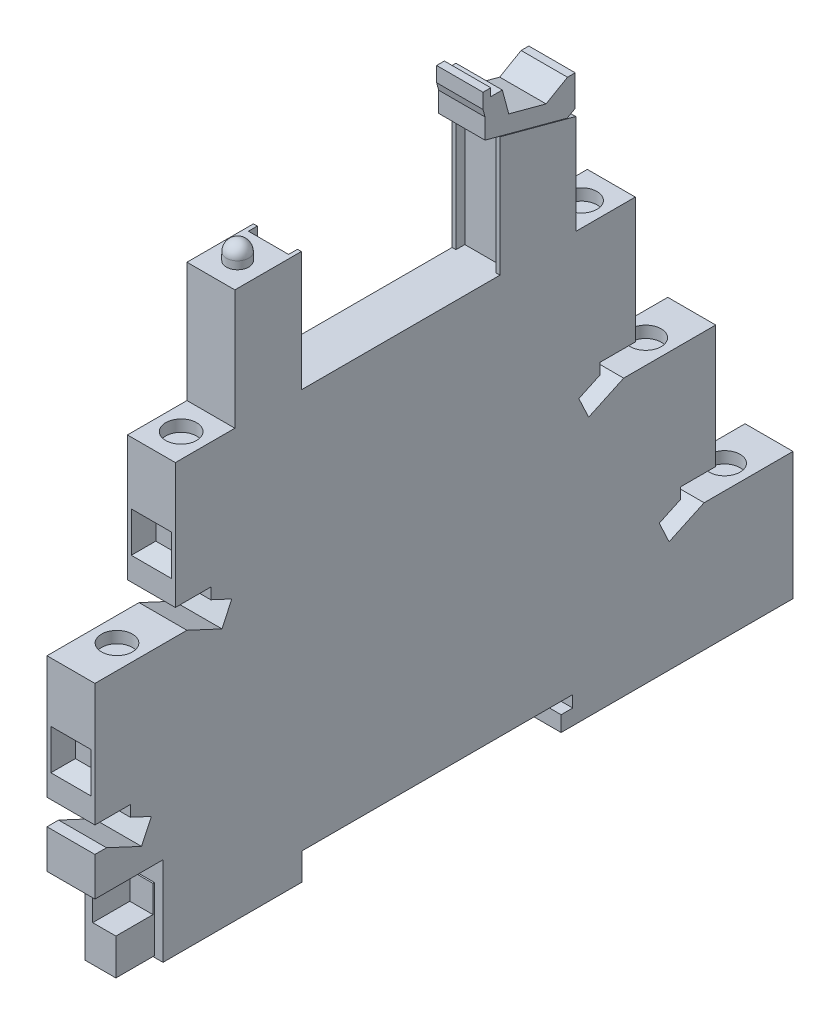
from build123d import *

# Parameters (mm, degrees)
BOSS_EXTRUDE1_DEPTH      = 6.2
SKETCH2_W                = 5.2
SKETCH2_H                = 28
CUT_EXTRUDE1_DEPTH       = 15.5
SKETCH3_R                = 1.45
BOSS_EXTRUDE2_DEPTH      = 1
DOME1_FACE_RADIUS        = 1.45
DOME1_HEIGHT             = 1.45
SKETCH4_W                = 4
SKETCH4_H                = 8.2
BOSS_EXTRUDE3_DEPTH      = 5
SKETCH5_W                = 3
SKETCH5_H                = 3.5
CUT_EXTRUDE2_DEPTH       = 4.8
SKETCH6_W                = 4
SKETCH6_H                = 2
BOSS_EXTRUDE4_DEPTH      = 1.5
BOSS_EXTRUDE4_TAPER      = 15
BOSS_EXTRUDE5_DEPTH      = 3
BOSS_EXTRUDE5_DEPTH_BACK = 3
SKETCH8_R                = 2
CUT_EXTRUDE3_DEPTH       = 1.5
SKETCH9_R                = 2
CUT_EXTRUDE4_DEPTH       = 1.5
SKETCH10_R               = 2
CUT_EXTRUDE5_DEPTH       = 1.5
SKETCH11_W               = 5.2
SKETCH11_H               = 5.2
CUT_EXTRUDE6_DEPTH       = 2.5
CUT_EXTRUDE6_DRAFT       = -15
SKETCH12_W               = 5.2
SKETCH12_H               = 5.2
CUT_EXTRUDE7_DEPTH       = 2.5
CUT_EXTRUDE7_DRAFT       = -15
SKETCH13_W               = 5.2
SKETCH13_H               = 5.2
CUT_EXTRUDE8_DEPTH       = 2.5
CUT_EXTRUDE8_DRAFT       = -15
SKETCH14_W               = 5.2
SKETCH14_H               = 5.2
CUT_EXTRUDE9_DEPTH       = 2.5
CUT_EXTRUDE9_DRAFT       = -15
SKETCH15_W               = 5.2
SKETCH15_H               = 5.2
CUT_EXTRUDE10_DEPTH      = 2.5
CUT_EXTRUDE10_DRAFT      = -15


with BuildPart() as part:
    # Sketch1 → Boss-Extrude1 (new body)
    with BuildSketch(Plane(origin=(0, 0, 0), x_dir=(0, 0, -1), z_dir=(1, 0, 0))):
        Polygon((0, 0), (0, 3.5), (35, 3.5), (35, 2), (33.5, 2), (33.5, 0), (63.5, 0), (63.5, 16.5), (52, 16.5), (47.468461065, 14.386908691), (46.20060628, 17.105832052), (48.919529641, 18.373686838), (48.919529641, 19.8), (53.5, 19.8), (53.5, 35.663086876), (41.594285018, 35.663086876), (37.062746083, 33.549995567), (35.794891298, 36.268918928), (38.513814659, 37.536773714), (38.513814659, 38.963086876), (43.094285018, 38.963086876), (43.094285018, 55.2), (35.394285018, 55.2), (35.394285018, 68.074097914), (25.594285018, 70.7), (25.594285018, 55.2), (-0.105714982, 55.2), (-0.105714982, 70.7), (-8.705714982, 70.7), (-8.705714982, 55.2), (-16.405714982, 55.2), (-16.405714982, 38.963086876), (-11.825244622, 38.963086876), (-11.825244622, 37.536773714), (-9.106321261, 36.268918928), (-10.374176047, 33.549995567), (-14.905714982, 35.663086876), (-26.811429963, 35.663086876), (-26.811429963, 19.8), (-22.230959604, 19.8), (-22.230959604, 18.373686838), (-19.512036243, 17.105832052), (-20.779891028, 14.386908691), (-25.311429963, 16.5), (-26.811429963, 16.5), (-26.811429963, 11.5), (-18, 11.5), (-18, 0), align=None)
    extrude(amount=BOSS_EXTRUDE1_DEPTH)

    # Sketch2 → Cut-Extrude1 (cut)
    with BuildSketch(Plane(origin=(0, 70.7, 0), x_dir=(1, 0, 0), z_dir=(0, 1, 0))):
        with Locations((3.1, 12.744285018)):
            Rectangle(SKETCH2_W, SKETCH2_H)
    extrude(amount=-CUT_EXTRUDE1_DEPTH, mode=Mode.SUBTRACT)

    # Sketch3 → Boss-Extrude2 (add)
    with BuildSketch(Plane(origin=(0, 70.7, 0), x_dir=(1, 0, 0), z_dir=(0, 1, 0))):
        with Locations(Location((3.1, -5.255714982, 0), (0, 0, 90))):
            Circle(SKETCH3_R)
    extrude(amount=BOSS_EXTRUDE2_DEPTH)

    # Dome1: a dome of height H over a round flat face of radius A is a cap of a sphere of radius (A * A + H * H) / (2 * H)
    dome1_r = (DOME1_FACE_RADIUS * DOME1_FACE_RADIUS + DOME1_HEIGHT * DOME1_HEIGHT) / (2 * DOME1_HEIGHT)
    dome1_base = Plane((3.1, 71.7, 5.255714982), z_dir=(0, 1, 0))
    with Locations(dome1_base.offset(DOME1_HEIGHT - dome1_r)):
        dome1_ball = Sphere(dome1_r, mode=Mode.PRIVATE)
    add(split(dome1_ball, bisect_by=dome1_base, keep=Keep.TOP, mode=Mode.PRIVATE))

    # Sketch4 → Boss-Extrude3 (add)
    with BuildSketch(Plane.XY.offset(18)):
        with Locations((3.1, 4.3)):
            Rectangle(SKETCH4_W, SKETCH4_H)
    extrude(amount=BOSS_EXTRUDE3_DEPTH)

    # Sketch5 → Cut-Extrude2 (cut)
    with BuildSketch(Plane.XY.offset(23)):
        with Locations((3.6, 6.65)):
            Rectangle(SKETCH5_W, SKETCH5_H)
    extrude(amount=-CUT_EXTRUDE2_DEPTH, mode=Mode.SUBTRACT)

    # Sketch6 → Boss-Extrude4 (add)
    with BuildSketch(Plane(origin=(0, 0, 0), x_dir=(-1, 0, 0), z_dir=(0, 0, -1))):
        with Locations((-3.1, 1)):
            Rectangle(SKETCH6_W, SKETCH6_H)
    extrude(amount=BOSS_EXTRUDE4_DEPTH, taper=BOSS_EXTRUDE4_TAPER)

    # Sketch7 → Boss-Extrude5 (add, two sides: drawn at the far end of the back side and taken through both)
    with BuildSketch(Plane(origin=(3.1, 0, 0), x_dir=(0, 0, -1), z_dir=(1, 0, 0)).offset(-BOSS_EXTRUDE5_DEPTH_BACK)):
        Polygon((34.380497445, 68.345741476), (23.755313356, 71.192750972), (23.755313356, 73.792750972), (23.496494311, 74.758676798), (23.496494311, 76.692750972), (24.496494311, 76.692750972), (24.496494311, 75.692750972), (25.996494311, 75.692750972), (26.824715255, 72.601788328), (31.654344387, 71.307693102), (34.425625679, 72.907693102), (35.425625679, 72.907693102), (35.425625679, 68.907693102), align=None)
    extrude(amount=BOSS_EXTRUDE5_DEPTH + BOSS_EXTRUDE5_DEPTH_BACK)

    # Sketch8 → Cut-Extrude3 (cut)
    with BuildSketch(Plane(origin=(0, 55.2, 0), x_dir=(1, 0, 0), z_dir=(0, 1, 0))):
        with Locations(Location((3.1, 39.244285018, 0), (0, 0, 270))):
            Circle(SKETCH8_R)
        with Locations(Location((3.1, -12.555714982, 0), (0, 0, 270))):
            Circle(SKETCH8_R)
    extrude(amount=-CUT_EXTRUDE3_DEPTH, mode=Mode.SUBTRACT)

    # Sketch9 → Cut-Extrude4 (cut)
    with BuildSketch(Plane(origin=(0, 35.663086876, 0), x_dir=(1, 0, 0), z_dir=(0, 1, 0))):
        with Locations(Location((3.1, 47.547142509, 0), (0, 0, 270))):
            Circle(SKETCH9_R)
        with Locations(Location((3.1, -20.858572473, 0), (0, 0, 270))):
            Circle(SKETCH9_R)
    extrude(amount=-CUT_EXTRUDE4_DEPTH, mode=Mode.SUBTRACT)

    # Sketch10 → Cut-Extrude5 (cut)
    with BuildSketch(Plane(origin=(0, 16.5, 0), x_dir=(1, 0, 0), z_dir=(0, 1, 0))):
        with Locations(Location((3.1, 57.75, 0), (0, 0, 270))):
            Circle(SKETCH10_R)
    extrude(amount=-CUT_EXTRUDE5_DEPTH, mode=Mode.SUBTRACT)


with BuildPart() as cut_extrude6_tool:
    # Sketch11 → Cut-Extrude6 (with draft: the straight prism first)
    with BuildSketch(Plane(origin=(0, 0, -63.5), x_dir=(-1, 0, 0), z_dir=(0, 0, -1))):
        with Locations((-3.1, 5.6)):
            Rectangle(SKETCH11_W, SKETCH11_H)
    extrude(amount=-CUT_EXTRUDE6_DEPTH)
    # Cut-Extrude6: the draft: its side faces are tilted about the plane it starts from
    cut_extrude6_sides = [cut_extrude6_tool.faces().sort_by_distance(p)[0] for p in [
        (3.1, 3, -62.25),
        (0.5, 5.6, -62.25),
        (3.1, 8.2, -62.25),
        (5.7, 5.6, -62.25),
    ]]
    draft(cut_extrude6_sides, Plane(origin=(0, 0, -63.5), x_dir=(-1, 0, 0), z_dir=(0, 0, -1)), CUT_EXTRUDE6_DRAFT)


with BuildPart() as part_1:
    add(part.part)

    # Cut-Extrude6: cut by cut_extrude6_tool
    add(cut_extrude6_tool.part, mode=Mode.SUBTRACT)


with BuildPart() as cut_extrude7_tool:
    # Sketch12 → Cut-Extrude7 (with draft: the straight prism first)
    with BuildSketch(Plane(origin=(0, 0, -53.5), x_dir=(-1, 0, 0), z_dir=(0, 0, -1))):
        with Locations((-3.1, 25.4)):
            Rectangle(SKETCH12_W, SKETCH12_H)
    extrude(amount=-CUT_EXTRUDE7_DEPTH)
    # Cut-Extrude7: the draft: its side faces are tilted about the plane it starts from
    cut_extrude7_sides = [cut_extrude7_tool.faces().sort_by_distance(p)[0] for p in [
        (3.1, 22.8, -52.25),
        (0.5, 25.4, -52.25),
        (3.1, 28, -52.25),
        (5.7, 25.4, -52.25),
    ]]
    draft(cut_extrude7_sides, Plane(origin=(0, 0, -53.5), x_dir=(-1, 0, 0), z_dir=(0, 0, -1)), CUT_EXTRUDE7_DRAFT)


with BuildPart() as part_2:
    add(part_1.part)

    # Cut-Extrude7: cut by cut_extrude7_tool
    add(cut_extrude7_tool.part, mode=Mode.SUBTRACT)


with BuildPart() as cut_extrude8_tool:
    # Sketch13 → Cut-Extrude8 (with draft: the straight prism first)
    with BuildSketch(Plane(origin=(0, 0, -43.094285018), x_dir=(-1, 0, 0), z_dir=(0, 0, -1))):
        with Locations((-3.1, 44.563086876)):
            Rectangle(SKETCH13_W, SKETCH13_H)
    extrude(amount=-CUT_EXTRUDE8_DEPTH)
    # Cut-Extrude8: the draft: its side faces are tilted about the plane it starts from
    cut_extrude8_sides = [cut_extrude8_tool.faces().sort_by_distance(p)[0] for p in [
        (3.1, 41.963086876, -41.844285018),
        (0.5, 44.563086876, -41.844285018),
        (3.1, 47.163086876, -41.844285018),
        (5.7, 44.563086876, -41.844285018),
    ]]
    draft(cut_extrude8_sides, Plane(origin=(0, 0, -43.094285018), x_dir=(-1, 0, 0), z_dir=(0, 0, -1)), CUT_EXTRUDE8_DRAFT)


with BuildPart() as part_3:
    add(part_2.part)

    # Cut-Extrude8: cut by cut_extrude8_tool
    add(cut_extrude8_tool.part, mode=Mode.SUBTRACT)


with BuildPart() as cut_extrude9_tool:
    # Sketch14 → Cut-Extrude9 (with draft: the straight prism first)
    with BuildSketch(Plane.XY.offset(26.811429963)):
        with Locations((3.1, 25.4)):
            Rectangle(SKETCH14_W, SKETCH14_H)
    extrude(amount=-CUT_EXTRUDE9_DEPTH)
    # Cut-Extrude9: the draft: its side faces are tilted about the plane it starts from
    cut_extrude9_sides = [cut_extrude9_tool.faces().sort_by_distance(p)[0] for p in [
        (3.1, 22.8, 25.561429963),
        (5.7, 25.4, 25.561429963),
        (3.1, 28, 25.561429963),
        (0.5, 25.4, 25.561429963),
    ]]
    draft(cut_extrude9_sides, Plane.XY.offset(26.811429963), CUT_EXTRUDE9_DRAFT)


with BuildPart() as part_4:
    add(part_3.part)

    # Cut-Extrude9: cut by cut_extrude9_tool
    add(cut_extrude9_tool.part, mode=Mode.SUBTRACT)


with BuildPart() as cut_extrude10_tool:
    # Sketch15 → Cut-Extrude10 (with draft: the straight prism first)
    with BuildSketch(Plane.XY.offset(16.405714982)):
        with Locations((3.1, 44.563086876)):
            Rectangle(SKETCH15_W, SKETCH15_H)
    extrude(amount=-CUT_EXTRUDE10_DEPTH)
    # Cut-Extrude10: the draft: its side faces are tilted about the plane it starts from
    cut_extrude10_sides = [cut_extrude10_tool.faces().sort_by_distance(p)[0] for p in [
        (3.1, 41.963086876, 15.155714982),
        (5.7, 44.563086876, 15.155714982),
        (3.1, 47.163086876, 15.155714982),
        (0.5, 44.563086876, 15.155714982),
    ]]
    draft(cut_extrude10_sides, Plane.XY.offset(16.405714982), CUT_EXTRUDE10_DRAFT)


with BuildPart() as part_5:
    add(part_4.part)

    # Cut-Extrude10: cut by cut_extrude10_tool
    add(cut_extrude10_tool.part, mode=Mode.SUBTRACT)


solid = part_5.part
